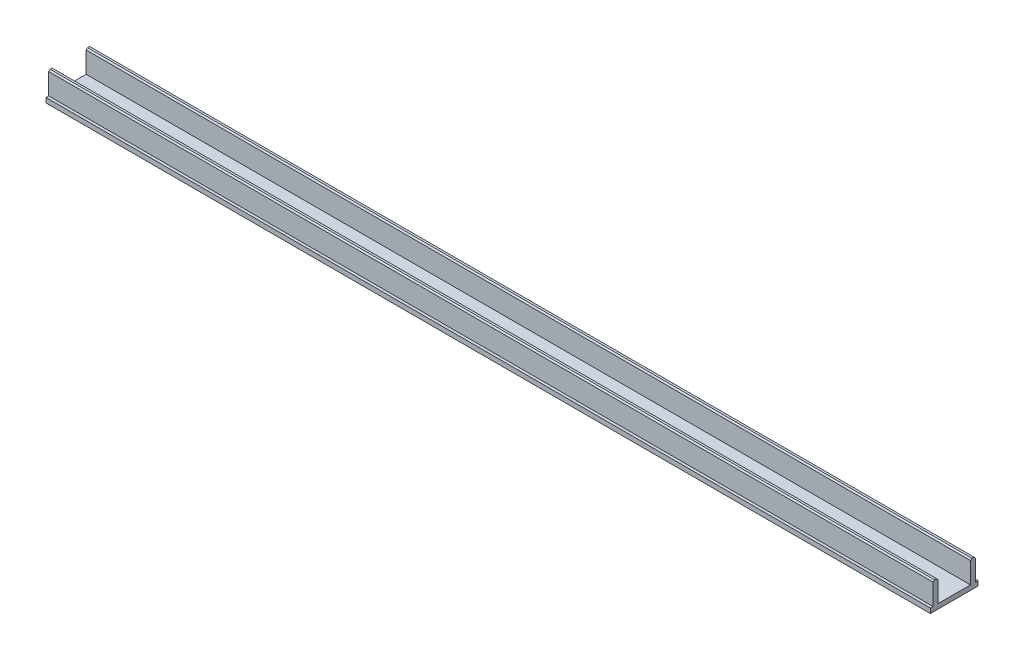
from build123d import *

# Parameters (mm, degrees)
EXTRUDE_1_DEPTH = 130
CHAMFER_1_SIZE  = 0.2


with BuildPart() as part:
    # 草图1 → 凸台-拉伸1 (new body)
    with BuildSketch(Plane(origin=(0, 0, 0), x_dir=(0, 0, -1), z_dir=(1, 0, 0))):
        Polygon((2.4, 4), (3.1, 4), (3.1, 0.7), (3.5, 0.7), (3.5, 0), (-3.5, 0), (-3.5, 0.7), (-3.1, 0.7), (-3.1, 4), (-2.4, 4), (-2.4, 0.7), (2.4, 0.7), align=None)
    extrude(amount=EXTRUDE_1_DEPTH)

    # 倒角1
    chamfer_1_edges = [part.edges().sort_by_distance(p)[0] for p in [
        (65, 4, 3.1),
        (65, 4, 2.4),
        (65, 4, -2.4),
        (65, 4, -3.1),
    ]]
    chamfer(chamfer_1_edges, length=CHAMFER_1_SIZE)


solid = part.part
